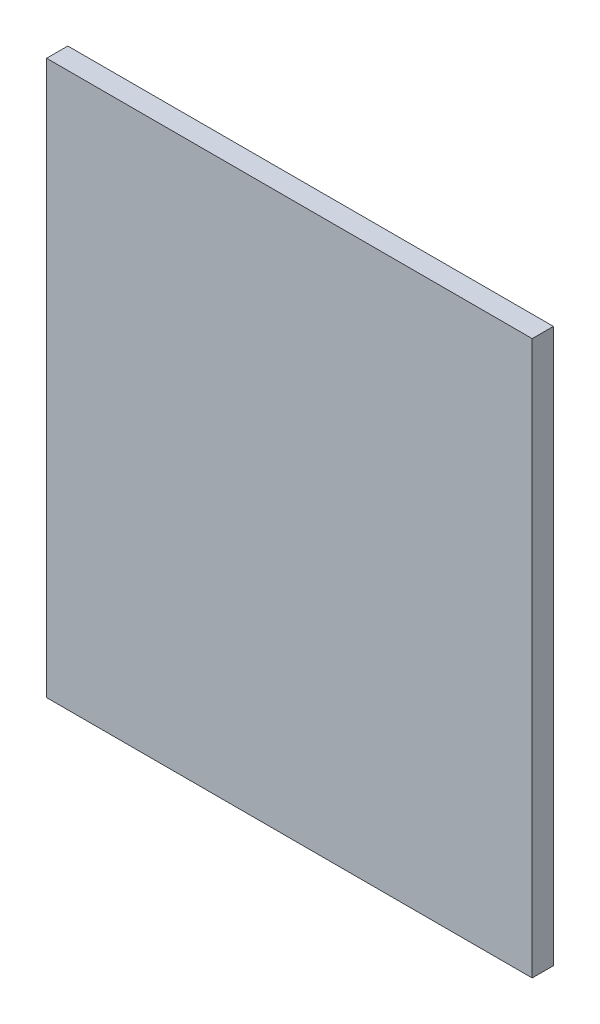
from build123d import *

# Parameters (mm, degrees)
SKETCH2_W           = 21.75
SKETCH2_H           = 0.95
BOSS_EXTRUDE1_DEPTH = 24.8


with BuildPart() as part:
    # Sketch2 → Boss-Extrude1 (new body)
    with BuildSketch(Plane(origin=(0, 0, 0), x_dir=(1, 0, 0), z_dir=(0, 1, 0))):
        with Locations((-39.506997502, 12.838110088)):
            Rectangle(SKETCH2_W, SKETCH2_H)
    extrude(amount=BOSS_EXTRUDE1_DEPTH)


solid = part.part
